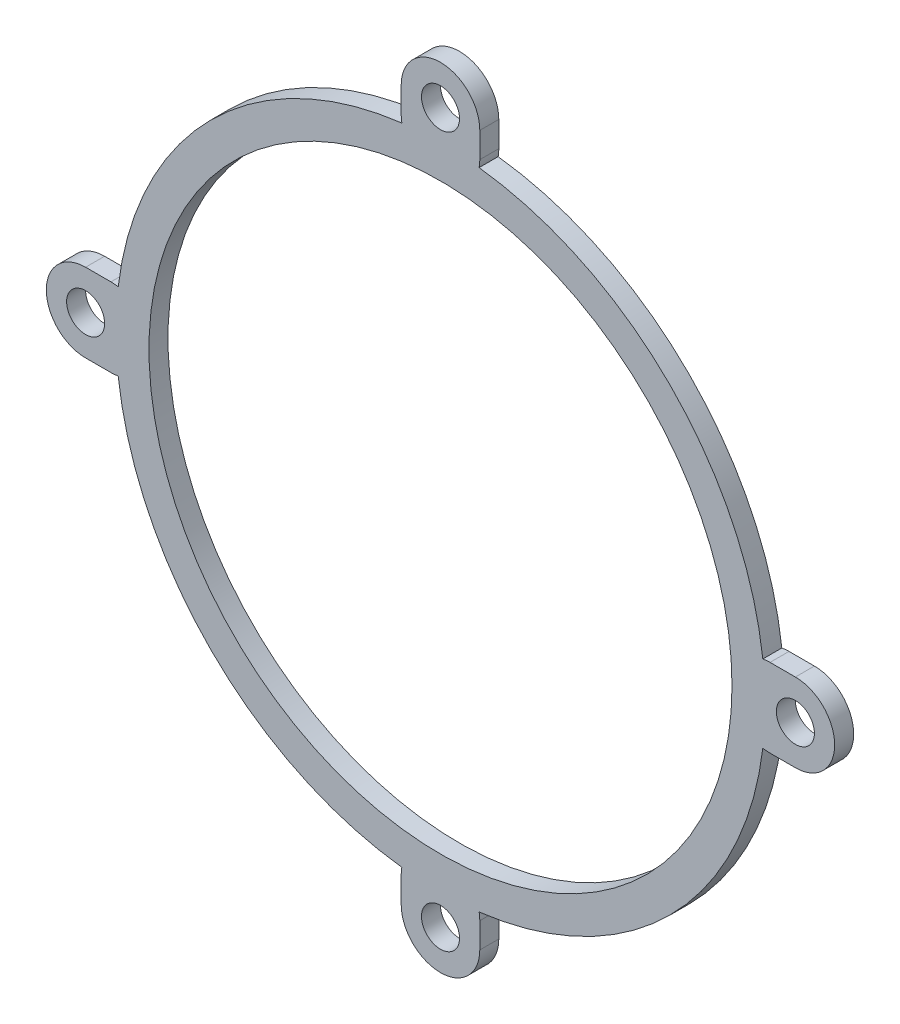
from build123d import *

# Parameters (mm, degrees)
SKETCH2_R           = 23
SKETCH2_R_2         = 1.5
BOSS_EXTRUDE1_DEPTH = 1.5


with BuildPart() as part:
    # Sketch2 → Boss-Extrude1 (new body)
    with BuildSketch(Plane.XY):
        with BuildLine():
            Line((26, -3.1), (28, -3.1))
            ThreePointArc((28, -3.1), (31.1, 0), (28, 3.1))
            Line((28, 3.1), (26, 3.1))
            ThreePointArc((26, 3.1), (25.713286425, 3.086712705), (25.429030688, 3.046964726))
            ThreePointArc((25.429030688, 3.046964726), (18.109660347, 18.109660347), (3.046964726, 25.429030688))
            ThreePointArc((3.046964726, 25.429030688), (3.086712705, 25.713286425), (3.1, 26))
            Line((3.1, 26), (3.1, 28))
            ThreePointArc((3.1, 28), (0, 31.1), (-3.1, 28))
            Line((-3.1, 28), (-3.1, 26))
            ThreePointArc((-3.1, 26), (-3.086712705, 25.713286425), (-3.046964726, 25.429030688))
            ThreePointArc((-3.046964726, 25.429030688), (-18.109660347, 18.109660347), (-25.429030688, 3.046964726))
            ThreePointArc((-25.429030688, 3.046964726), (-25.713286425, 3.086712705), (-26, 3.1))
            Line((-26, 3.1), (-28, 3.1))
            ThreePointArc((-28, 3.1), (-31.1, 0), (-28, -3.1))
            Line((-28, -3.1), (-26, -3.1))
            ThreePointArc((-26, -3.1), (-25.713286425, -3.086712705), (-25.429030688, -3.046964726))
            ThreePointArc((-25.429030688, -3.046964726), (-18.109660347, -18.109660347), (-3.046964726, -25.429030688))
            ThreePointArc((-3.046964726, -25.429030688), (-3.086712705, -25.713286425), (-3.1, -26))
            Line((-3.1, -26), (-3.1, -28))
            ThreePointArc((-3.1, -28), (0, -31.1), (3.1, -28))
            Line((3.1, -28), (3.1, -26))
            ThreePointArc((3.1, -26), (3.086712705, -25.713286425), (3.046964726, -25.429030688))
            ThreePointArc((3.046964726, -25.429030688), (18.109660347, -18.109660347), (25.429030688, -3.046964726))
            ThreePointArc((25.429030688, -3.046964726), (25.713286425, -3.086712705), (26, -3.1))
        make_face()
        Circle(SKETCH2_R, mode=Mode.SUBTRACT)
        with Locations((-28, 0)):
            Circle(SKETCH2_R_2, mode=Mode.SUBTRACT)
        with Locations((0, 28)):
            Circle(SKETCH2_R_2, mode=Mode.SUBTRACT)
        with Locations((28, 0)):
            Circle(SKETCH2_R_2, mode=Mode.SUBTRACT)
        with Locations((0, -28)):
            Circle(SKETCH2_R_2, mode=Mode.SUBTRACT)
    extrude(amount=BOSS_EXTRUDE1_DEPTH)


solid = part.part
